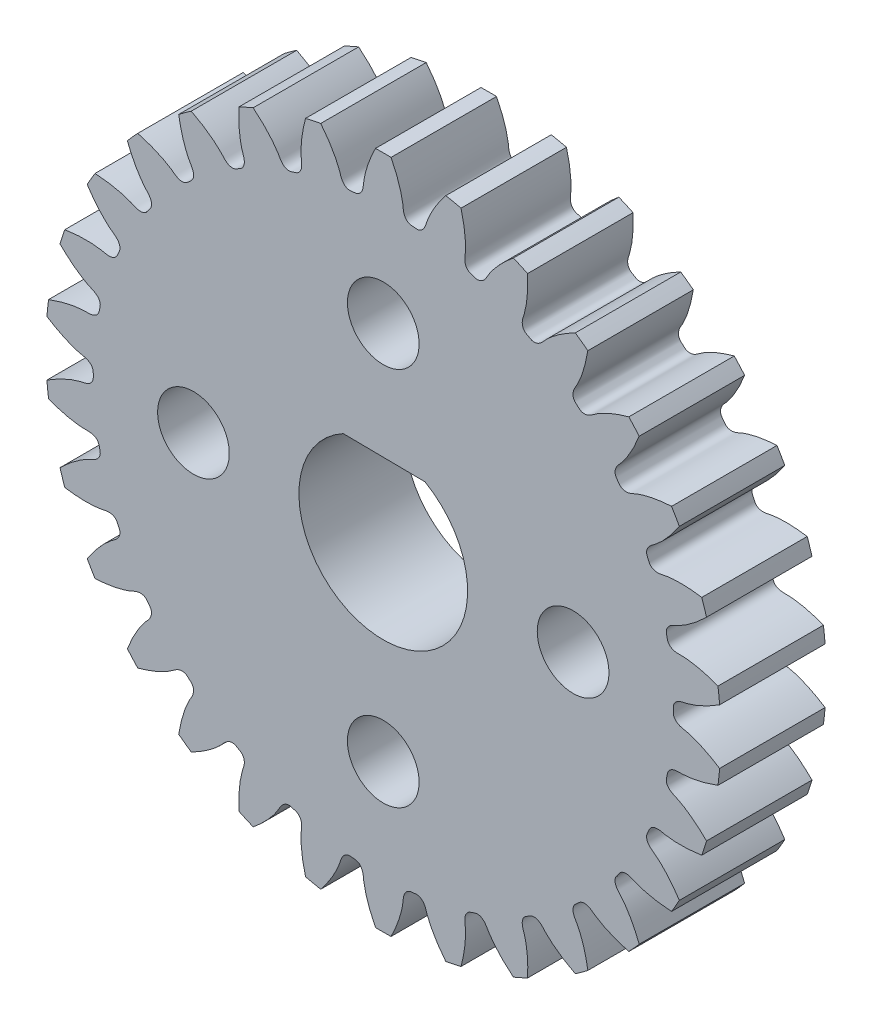
from build123d import *

# Parameters (mm, degrees)
SKETCHREVOLVESPURASSEM30_42M1PINION_W                = 5
SKETCHREVOLVESPURASSEM30_42M1PINION_H                = 15.99999976
TOOTHEXTRUDECUTSPURASSEM30_42M1PINION_DEPTH          = 2.5
PATTERNSPURASSEM30_42M1PINION_COUNT                  = 30
BOREREVOLVESKETCH_W                                  = 5
BOREREVOLVESKETCH_H                                  = 2.5
CUT_EXTRUDE2_DEPTH                                   = 10
SKETCH6_R                                            = 1.6
CUT_EXTRUDE3_DEPTH                                   = 3
CSK_FOR_M3_HEX_SOCKET_COUNTERSUNK_HEAD_S_D           = 3.4
CSK_FOR_M3_HEX_SOCKET_COUNTERSUNK_HEAD_S_CSINK_D     = 6.94
CSK_FOR_M3_HEX_SOCKET_COUNTERSUNK_HEAD_S_CSINK_ANGLE = 90


with BuildPart() as part:
    # SketchRevolveSpurAssem30-42M1Pinion → SpurAssem30-42M1Pinion (revolve)
    with BuildSketch(Plane(origin=(0, 0, 0), x_dir=(0, 0, -1), z_dir=(1, 0, 0))):
        with Locations((0, 7.99999988)):
            Rectangle(SKETCHREVOLVESPURASSEM30_42M1PINION_W, SKETCHREVOLVESPURASSEM30_42M1PINION_H)
    revolve(axis=Axis((0, 0, 0), (0, 0, -1)))

    # SketchToothSpurAssem30-42M1Pinion → ToothExtrudeCutSpurAssem30-42M1Pinion (cut, symmetric)
    with BuildSketch(Plane.XY):
        with BuildLine():
            ThreePointArc((15.994262455, 1.336435852), (16.049999759, 0), (15.994262455, -1.336435852))
            add(Edge.make_bspline(
                [(15.994262455, -1.336435852), (15.883683434, -1.263671373), (15.719431793, -1.161542795), (15.501048403, -1.038136306), (15.348657479, -0.957410339), (15.203492731, -0.88549847), (15.06591414, -0.821944254), (14.936262253, -0.766277478), (14.814857035, -0.718018173), (14.701999821, -0.676667177), (14.597965201, -0.641740229), (14.503025819, -0.612660389), (14.417371409, -0.589106214), (14.302358773, -0.560070867), (14.204626476, -0.544350705), (14.125321533, -0.522450137), (14.097690649, -0.513906426), (14.070626776, -0.504545974), (14.044057415, -0.494282507), (14.017901013, -0.482996535), (13.992070084, -0.470531891), (13.966475209, -0.456683712), (13.941033728, -0.441185901), (13.915685358, -0.423696673), (13.890418889, -0.403785177), (13.865314911, -0.380924779), (13.840609, -0.354504531), (13.816774405, -0.323877748), (13.794608428, -0.288473904), (13.775279613, -0.247987455), (13.76026271, -0.202643333), (13.751600882, -0.156078233), (13.748001301, -0.088052706), (13.75143344, 0), (13.748001301, 0.088052706), (13.751600882, 0.156078233), (13.76026271, 0.202643333), (13.775279613, 0.247987455), (13.794608428, 0.288473904), (13.816774405, 0.323877748), (13.840609, 0.354504531), (13.865314911, 0.380924779), (13.890418889, 0.403785177), (13.915685358, 0.423696673), (13.941033728, 0.441185901), (13.966475209, 0.456683712), (13.992070084, 0.470531891), (14.017901013, 0.482996535), (14.044057415, 0.494282507), (14.070626776, 0.504545974), (14.097690649, 0.513906426), (14.125321533, 0.522450137), (14.204626476, 0.544350705), (14.302358773, 0.560070867), (14.417371409, 0.589106214), (14.503025819, 0.612660389), (14.597965201, 0.641740229), (14.701999821, 0.676667177), (14.814857035, 0.718018173), (14.936262253, 0.766277478), (15.06591414, 0.821944254), (15.203492731, 0.88549847), (15.348657479, 0.957410339), (15.501048403, 1.038136306), (15.719431793, 1.161542795), (15.883683434, 1.263671373), (15.994262455, 1.336435852)],
                knots=[0, 0, 0, 0, 0.071865675, 0.104961709, 0.136166541, 0.165480172, 0.1929026, 0.218433827, 0.242073852, 0.263822675, 0.283680296, 0.301646715, 0.317721932, 0.331905947, 0.366034352, 0.371334023, 0.376560671, 0.381734146, 0.3868781, 0.392020792, 0.397196045, 0.402444319, 0.407813848, 0.413361641, 0.419153999, 0.425265839, 0.431777669, 0.438768527, 0.446303002, 0.454411516, 0.463066602, 0.472163953, 0.480031429, 0.5, 0.519968571, 0.527836047, 0.536933398, 0.545588484, 0.553696998, 0.561231473, 0.568222331, 0.574734161, 0.580846001, 0.586638359, 0.592186152, 0.597555681, 0.602803955, 0.607979208, 0.6131219, 0.618265854, 0.623439329, 0.628665977, 0.633965648, 0.668094053, 0.682278068, 0.698353285, 0.716319704, 0.736177325, 0.757926148, 0.781566173, 0.8070974, 0.834519828, 0.863833459, 0.895038291, 0.928134325, 1, 1, 1, 1], degree=3))
        make_face()
    toothextrudecutspurassem30_42m1pinion = extrude(amount=TOOTHEXTRUDECUTSPURASSEM30_42M1PINION_DEPTH, both=True, mode=Mode.SUBTRACT)

    # PatternSpurAssem30-42M1Pinion: ToothExtrudeCutSpurAssem30-42M1Pinion ×30 about axis
    patternspurassem30_42m1pinion_axis = Axis((0, 0, 55), (0, 0, -1))
    for i in range(1, PATTERNSPURASSEM30_42M1PINION_COUNT):
        add(toothextrudecutspurassem30_42m1pinion.rotate(patternspurassem30_42m1pinion_axis, i * 360 / PATTERNSPURASSEM30_42M1PINION_COUNT), mode=Mode.SUBTRACT)

    # BoreRevolveSketch → BoreRevolveCut (revolve, cut)
    with BuildSketch(Plane(origin=(0, 0, 0), x_dir=(0, 0, -1), z_dir=(1, 0, 0))):
        with Locations((0, 1.25)):
            Rectangle(BOREREVOLVESKETCH_W, BOREREVOLVESKETCH_H)
    revolve(axis=Axis((0, 0, 0), (0, 0, -1)), mode=Mode.SUBTRACT)

    # Sketch5 → Cut-Extrude2 (cut)
    with BuildSketch(Plane.XY.offset(2.5)):
        with BuildLine():
            Line((-1.896841157, 3.521646437), (1.975895198, 3.477907153))
            ThreePointArc((1.975895198, 3.477907153), (-0.045173738, -3.999744909), (-1.896841157, 3.521646437))
        make_face()
    extrude(amount=-CUT_EXTRUDE2_DEPTH, mode=Mode.SUBTRACT)

    # Sketch6 → Cut-Extrude3 (cut)
    with BuildSketch(Plane(origin=(0, 0, -2.5), x_dir=(-1, 0, 0), z_dir=(0, 0, -1))):
        with Locations((-9, 0)):
            Circle(SKETCH6_R)
        with Locations((0, 9)):
            Circle(SKETCH6_R)
        with Locations((9, 0)):
            Circle(SKETCH6_R)
        with Locations((0, -9)):
            Circle(SKETCH6_R)
    extrude(amount=-CUT_EXTRUDE3_DEPTH, mode=Mode.SUBTRACT)

    # CSK for M3 Hex Socket Countersunk Head Screw2 (through all)
    with Locations(Plane(origin=(0, 0, -2.5), x_dir=(-1, 0, 0), z_dir=(0, 0, -1))):
        with Locations((0, 9), (-9, 0), (0, -9), (9, 0)):
            CounterSinkHole(CSK_FOR_M3_HEX_SOCKET_COUNTERSUNK_HEAD_S_D / 2, CSK_FOR_M3_HEX_SOCKET_COUNTERSUNK_HEAD_S_CSINK_D / 2, counter_sink_angle=CSK_FOR_M3_HEX_SOCKET_COUNTERSUNK_HEAD_S_CSINK_ANGLE)


solid = part.part
